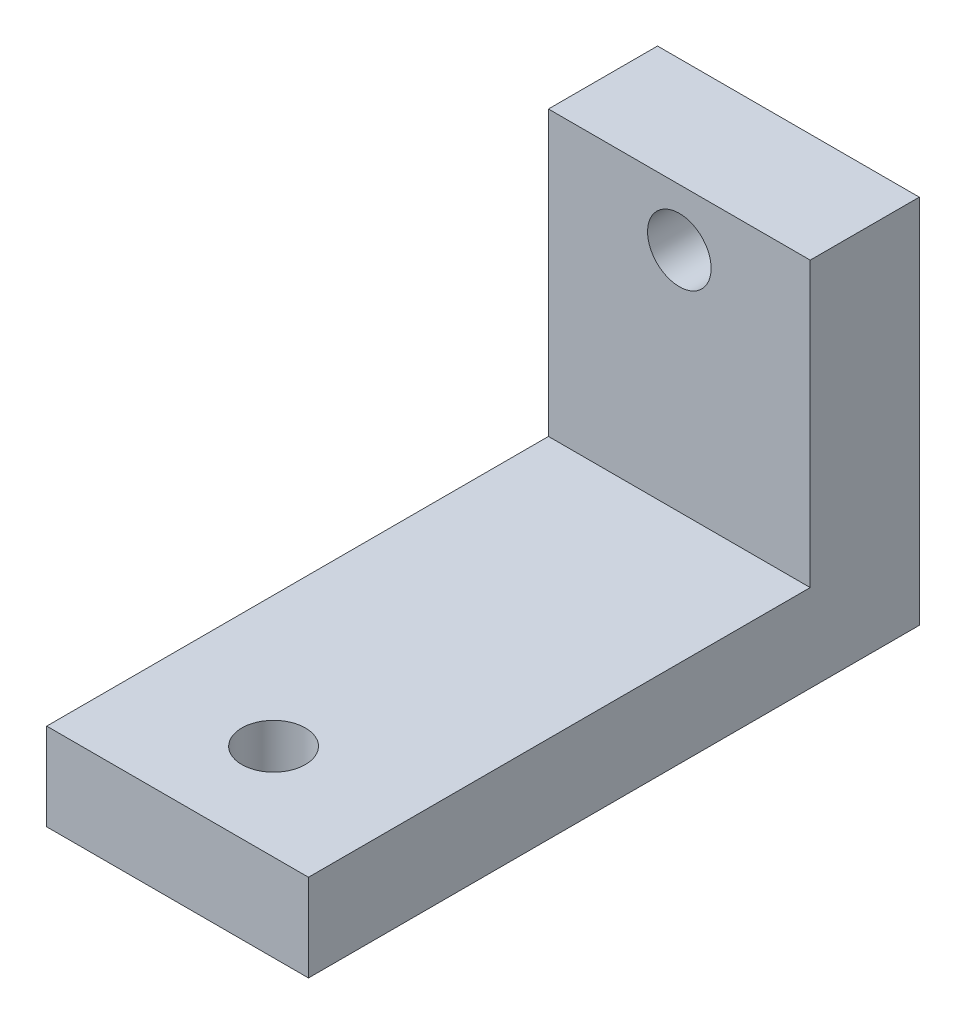
from build123d import *

# Parameters (mm, degrees)
SKETCH1_W                = 15.24
SKETCH1_H                = 6.35
BOSS_EXTRUDE1_DEPTH      = 21.59
SKETCH2_W                = 15.24
SKETCH2_H                = 5.08
BOSS_EXTRUDE2_DEPTH      = 29.21
M3_CLEARANCE_HOLE1_D     = 3.7
M3_CLEARANCE_HOLE1_DEPTH = 25.4
M3_CLEARANCE_HOLE1_TIP   = 1.111592145
M3_CLEARANCE_HOLE2_D     = 3.7
M3_CLEARANCE_HOLE2_DEPTH = 25.4
M3_CLEARANCE_HOLE2_TIP   = 1.111592145


with BuildPart() as part:
    # Sketch1 → Boss-Extrude1 (new body)
    with BuildSketch(Plane(origin=(0, 0, 0), x_dir=(1, 0, 0), z_dir=(0, 1, 0))):
        with Locations((0, -1.264380531)):
            Rectangle(SKETCH1_W, SKETCH1_H)
    extrude(amount=BOSS_EXTRUDE1_DEPTH)

    # Sketch2 → Boss-Extrude2 (add)
    with BuildSketch(Plane.XY.offset(4.439380531)):
        with Locations((0, 2.54)):
            Rectangle(SKETCH2_W, SKETCH2_H)
    extrude(amount=BOSS_EXTRUDE2_DEPTH)

    # M3 Clearance Hole1
    with Locations(Plane(origin=(0, 5.08, 0), x_dir=(1, 0, 0), z_dir=(0, 1, 0))):
        with Locations((0, -28.061380531)):
            Hole(M3_CLEARANCE_HOLE1_D / 2, depth=M3_CLEARANCE_HOLE1_DEPTH)
            with Locations((0, 0, -(M3_CLEARANCE_HOLE1_DEPTH + M3_CLEARANCE_HOLE1_TIP / 2))):  # 118° drill point
                Cone(0, M3_CLEARANCE_HOLE1_D / 2, M3_CLEARANCE_HOLE1_TIP, mode=Mode.SUBTRACT)

    # M3 Clearance Hole2
    with Locations(Plane.XY.offset(4.439380531)):
        with Locations((0, 18.288)):
            Hole(M3_CLEARANCE_HOLE2_D / 2, depth=M3_CLEARANCE_HOLE2_DEPTH)
            with Locations((0, 0, -(M3_CLEARANCE_HOLE2_DEPTH + M3_CLEARANCE_HOLE2_TIP / 2))):  # 118° drill point
                Cone(0, M3_CLEARANCE_HOLE2_D / 2, M3_CLEARANCE_HOLE2_TIP, mode=Mode.SUBTRACT)


solid = part.part
